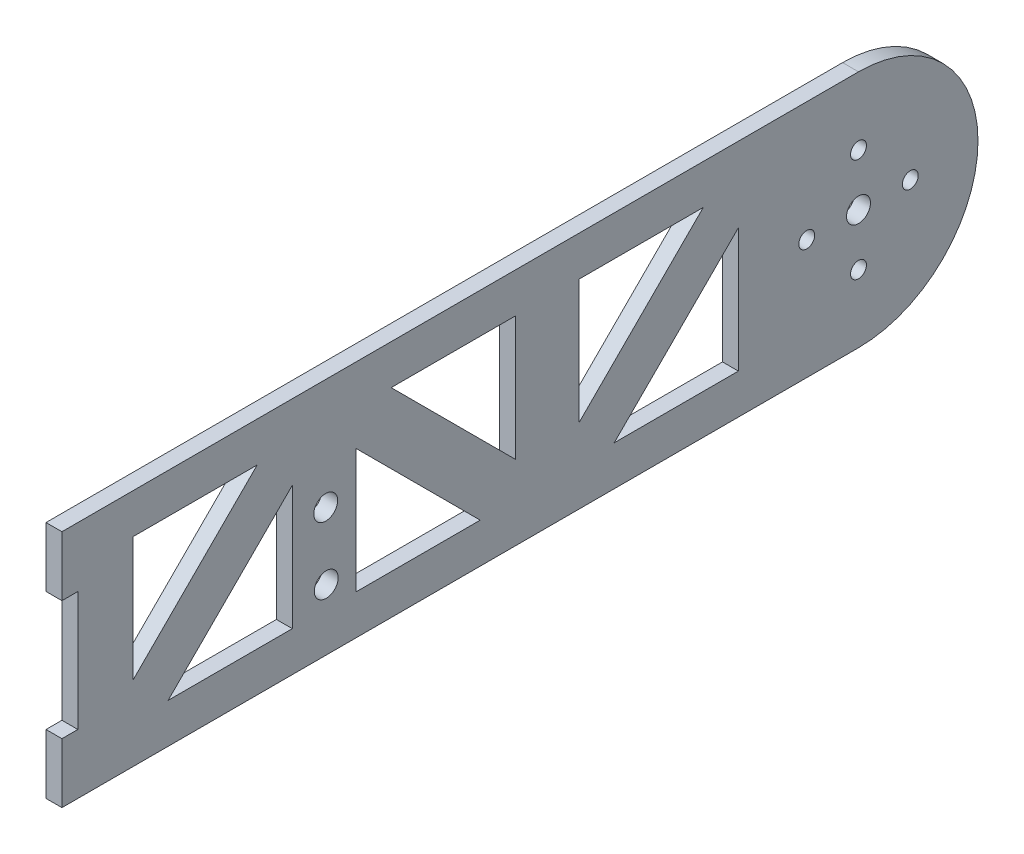
from build123d import *

# Parameters (mm, degrees)
SKETCH1_R           = 1.5
BOSS_EXTRUDE1_DEPTH = 2
SKETCH2_R           = 1
SKETCH2_R_2         = 1.5
CUT_EXTRUDE1_DEPTH  = 2
CIRPATTERN1_COUNT   = 4


with BuildPart() as part:
    # Sketch1 → Boss-Extrude1 (new body)
    with BuildSketch(Plane(origin=(0, 0, 0), x_dir=(0, 0, -1), z_dir=(1, 0, 0))):
        with BuildLine():
            Line((0, 15), (-100, 15))
            Line((-100, 15), (-100, 7.5))
            Line((-100, 7.5), (-98, 7.5))
            Line((-98, 7.5), (-98, -7.5))
            Line((-98, -7.5), (-100, -7.5))
            Line((-100, -7.5), (-100, -15))
            Line((-100, -15), (-70.810782002, -15))
            Line((-70.810782002, -15), (-68.551280878, -15))
            Line((-68.551280878, -15), (0, -15))
            ThreePointArc((0, -15), (15, 0), (0, 15))
        make_face()
        Circle(SKETCH1_R, mode=Mode.SUBTRACT)
        Polygon((-91.077825525, 10), (-75.487484581, 10), (-91.077825525, -5.590340945), align=None, mode=Mode.SUBTRACT)
        Polygon((-86.66816647, -10), (-73.439167119, -10), (-71.179665994, -10), (-71.077825525, -10), (-71.077825525, 5.590340945), align=None, mode=Mode.SUBTRACT)
        Polygon((-47.487484581, -10), (-63.077825525, -10), (-63.077825525, 5.590340945), align=None, mode=Mode.SUBTRACT)
        Polygon((-43.077825525, -5.590340945), (-58.66816647, 10), (-43.077825525, 10), align=None, mode=Mode.SUBTRACT)
        Polygon((-35.077825525, 10), (-35.077825525, -5.590340945), (-19.487484581, 10), align=None, mode=Mode.SUBTRACT)
        Polygon((-15.077825525, 5.590340945), (-15.077825525, -10), (-30.66816647, -10), align=None, mode=Mode.SUBTRACT)
    extrude(amount=BOSS_EXTRUDE1_DEPTH)

    # Sketch2 → Cut-Extrude1 (cut)
    with BuildSketch(Plane.ZY):
        with Locations((6.5, 0)):
            Circle(SKETCH2_R)
        with Locations((66.885344311, 1.095113855)):
            Circle(SKETCH2_R_2)
        with Locations((66.822152611, -7.327248895)):
            Circle(SKETCH2_R_2)
    cut_extrude1 = extrude(amount=-CUT_EXTRUDE1_DEPTH, mode=Mode.SUBTRACT)

    # CirPattern1: Cut-Extrude1 ×4 about axis
    cirpattern1_axis = Axis((0, 0, 0), (1, 0, 0))
    for i in range(1, CIRPATTERN1_COUNT):
        add(cut_extrude1.rotate(cirpattern1_axis, i * 360 / CIRPATTERN1_COUNT), mode=Mode.SUBTRACT)


solid = part.part
